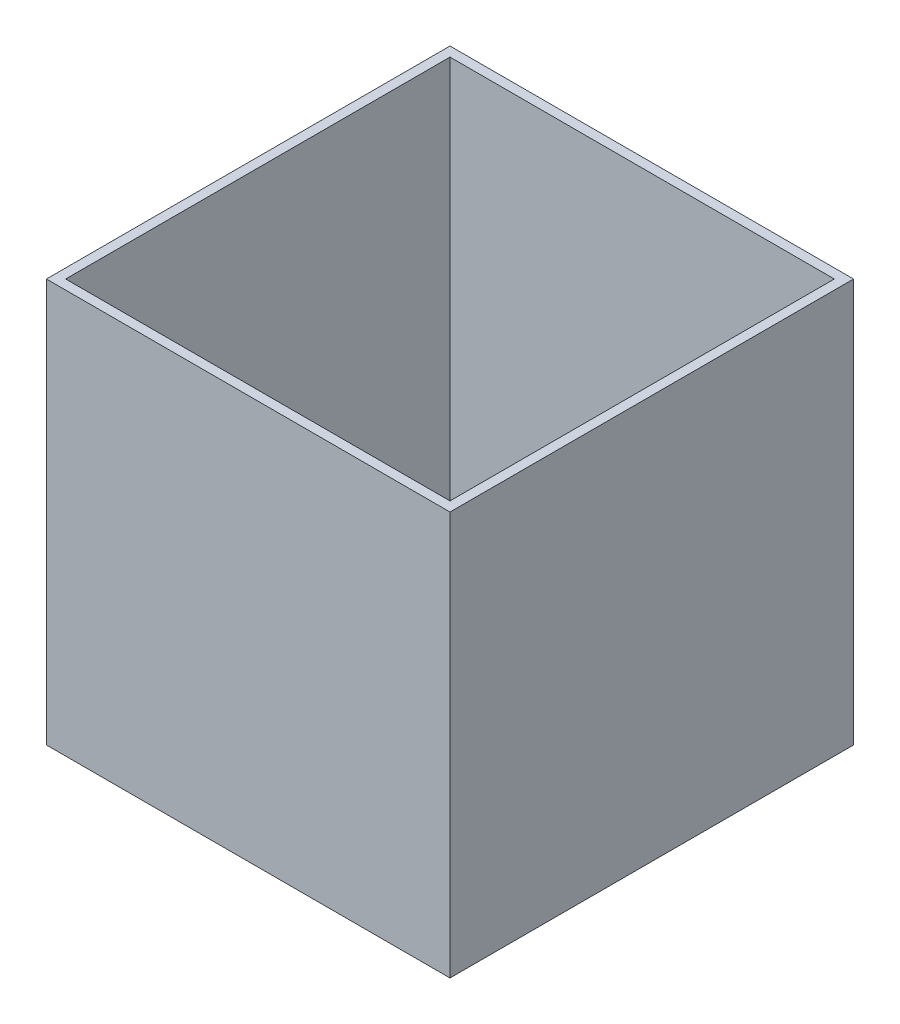
from build123d import *

# Parameters (mm, degrees)
SKETCH1_W           = 42
SKETCH1_H           = 42
BOSS_EXTRUDE2_DEPTH = 42
SKETCH3_W           = 40
SKETCH3_H           = 40
CUT_EXTRUDE1_DEPTH  = 40


with BuildPart() as part:
    # Sketch1 → Boss-Extrude2 (new body)
    with BuildSketch(Plane(origin=(0, 0, 0), x_dir=(1, 0, 0), z_dir=(0, 1, 0))):
        Rectangle(SKETCH1_W, SKETCH1_H)
    extrude(amount=BOSS_EXTRUDE2_DEPTH)

    # Sketch3 → Cut-Extrude1 (cut)
    with BuildSketch(Plane(origin=(0, 42, 0), x_dir=(1, 0, 0), z_dir=(0, 1, 0))):
        Rectangle(SKETCH3_W, SKETCH3_H)
    extrude(amount=-CUT_EXTRUDE1_DEPTH, mode=Mode.SUBTRACT)


solid = part.part
